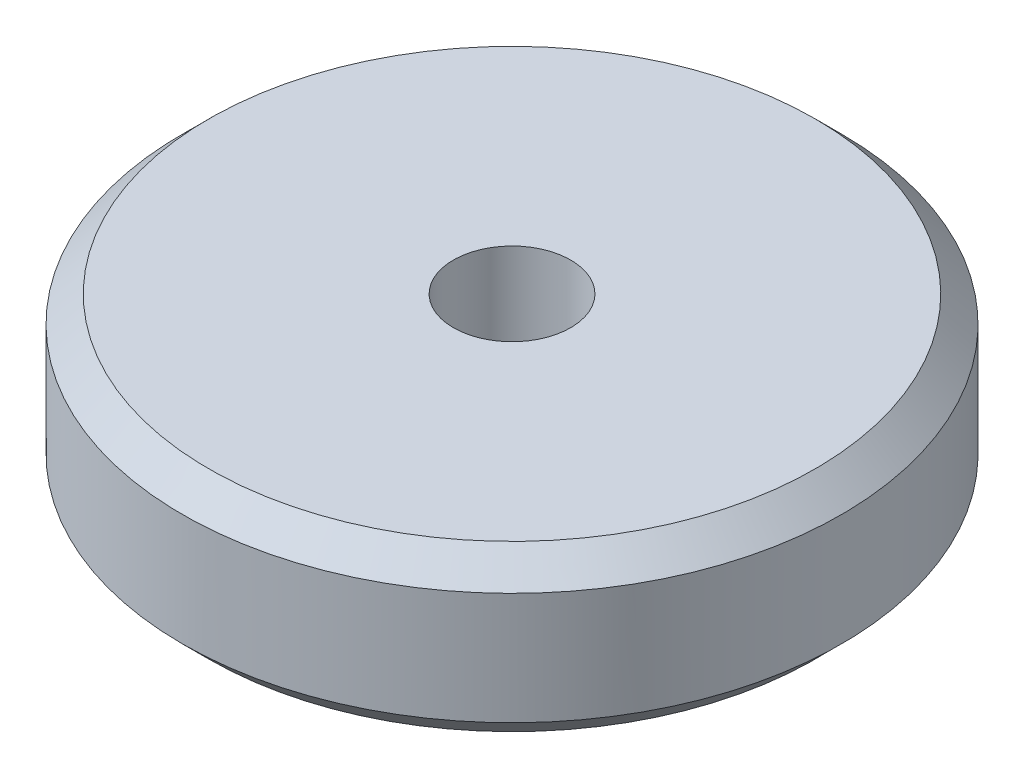
from build123d import *

# Parameters (mm, degrees)
SKETCH1_R             = 6.35
BOSS_EXTRUDE1_DEPTH   = 3.175
F_4_40_TAPPED_HOLE1_D = 2.2606
CHAMFER1_SIZE         = 0.508


with BuildPart() as part:
    # Sketch1 → Boss-Extrude1 (new body)
    with BuildSketch(Plane(origin=(0, 0, 0), x_dir=(1, 0, 0), z_dir=(0, 1, 0))):
        with Locations(Location((0, 0, 0), (0, 0, 270))):
            Circle(SKETCH1_R)
    extrude(amount=BOSS_EXTRUDE1_DEPTH)

    # #4-40 Tapped Hole1 (through all)
    with Locations(Plane(origin=(0, 3.175, 0), x_dir=(1, 0, 0), z_dir=(0, 1, 0))):
        with Locations((0, 0)):
            Hole(F_4_40_TAPPED_HOLE1_D / 2)

    # Chamfer1
    chamfer1_edges = [part.edges().sort_by_distance(p)[0] for p in [
        (0, 0, -6.35),
        (0, 3.175, -6.35),
    ]]
    chamfer(chamfer1_edges, length=CHAMFER1_SIZE)


solid = part.part
